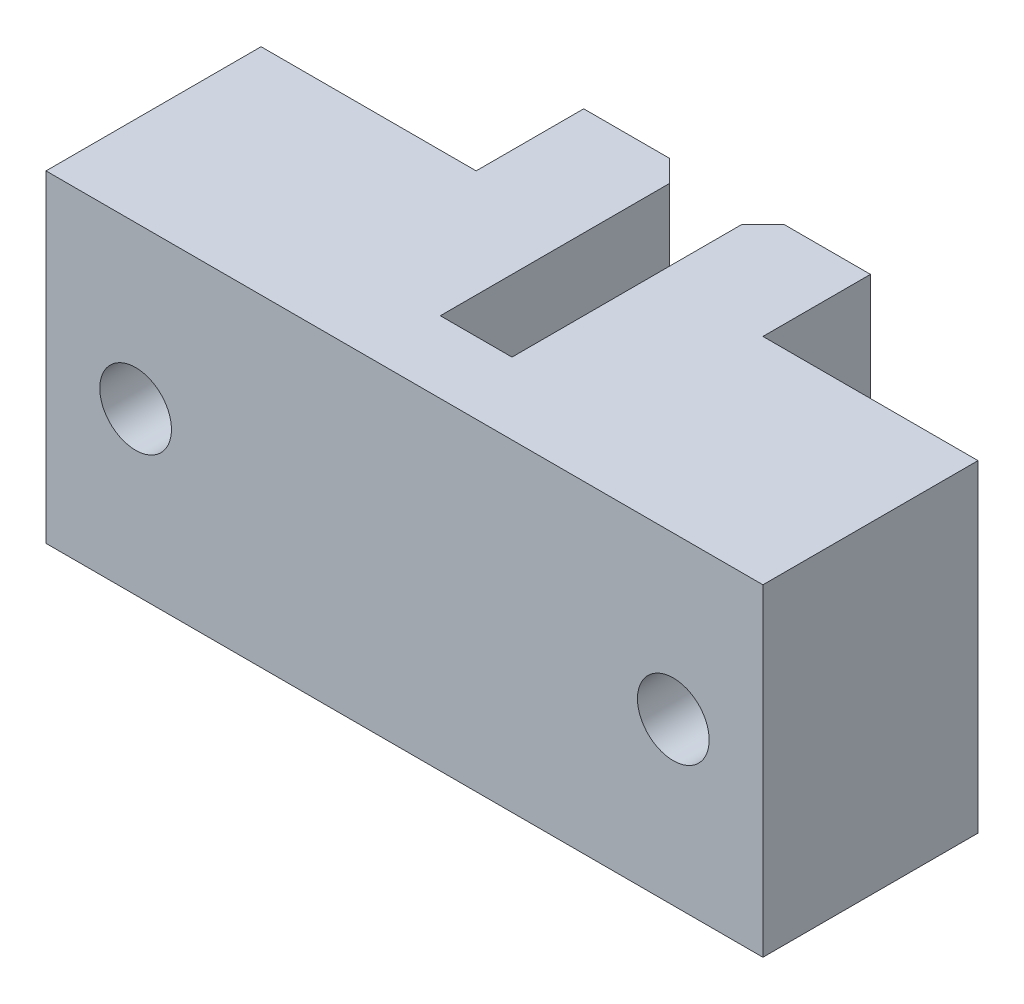
from build123d import *

# Parameters (mm, degrees)
EXTRUDE_1_DEPTH     = 22.5
SKETCH_2_R          = 8
CUT_EXTRUDE_1_DEPTH = 10
CUT_EXTRUDE_2_REACH = 62.26
SKETCH_3_R          = 5


with BuildPart() as part:
    # Эскиз1 → Бобышка-Вытянуть1 (new, symmetric)
    with BuildSketch(Plane(origin=(0, 0, 0), x_dir=(1, 0, 0), z_dir=(0, 1, 0))):
        Polygon((50, 0), (-50, 0), (-50, 30), (-20, 30), (-20, 45), (-8, 45), (-5, 42), (-5, 10), (5, 10), (5, 42), (8, 45), (20, 45), (20, 30), (50, 30), align=None)
    extrude(amount=EXTRUDE_1_DEPTH, both=True)

    # Эскиз2 → Вырез-Вытянуть1 (cut)
    with BuildSketch(Plane(origin=(0, 0, -30), x_dir=(-1, 0, 0), z_dir=(0, 0, -1))):
        with Locations((37.5, 0)):
            Circle(SKETCH_2_R)
    cut_extrude_1 = extrude(amount=-CUT_EXTRUDE_1_DEPTH, mode=Mode.SUBTRACT)

    # Эскиз3 → Вырез-Вытянуть2 (cut, up to next)
    with BuildSketch(Plane(origin=(0, 0, -20), x_dir=(-1, 0, 0), z_dir=(0, 0, -1)), mode=Mode.PRIVATE) as cut_extrude_2_sk1:
        with Locations((37.5, 0)):
            Circle(SKETCH_3_R)
    cut_extrude_2_tool1 = extrude(cut_extrude_2_sk1.sketch, amount=-CUT_EXTRUDE_2_REACH, mode=Mode.PRIVATE) & part.part
    cut_extrude_2 = cut_extrude_2_tool1.solids().sort_by_distance((-37.5, 0, -20))[0]
    add(cut_extrude_2, mode=Mode.SUBTRACT)

    # Зеркальное отражение1: Вырез-Вытянуть1, Вырез-Вытянуть2 across plane
    add(cut_extrude_1.mirror(Plane(origin=(0, 0, 0), x_dir=(0, 0, 1), z_dir=(1, 0, 0))), mode=Mode.SUBTRACT)
    add(cut_extrude_2.mirror(Plane(origin=(0, 0, 0), x_dir=(0, 0, 1), z_dir=(1, 0, 0))), mode=Mode.SUBTRACT)


solid = part.part
